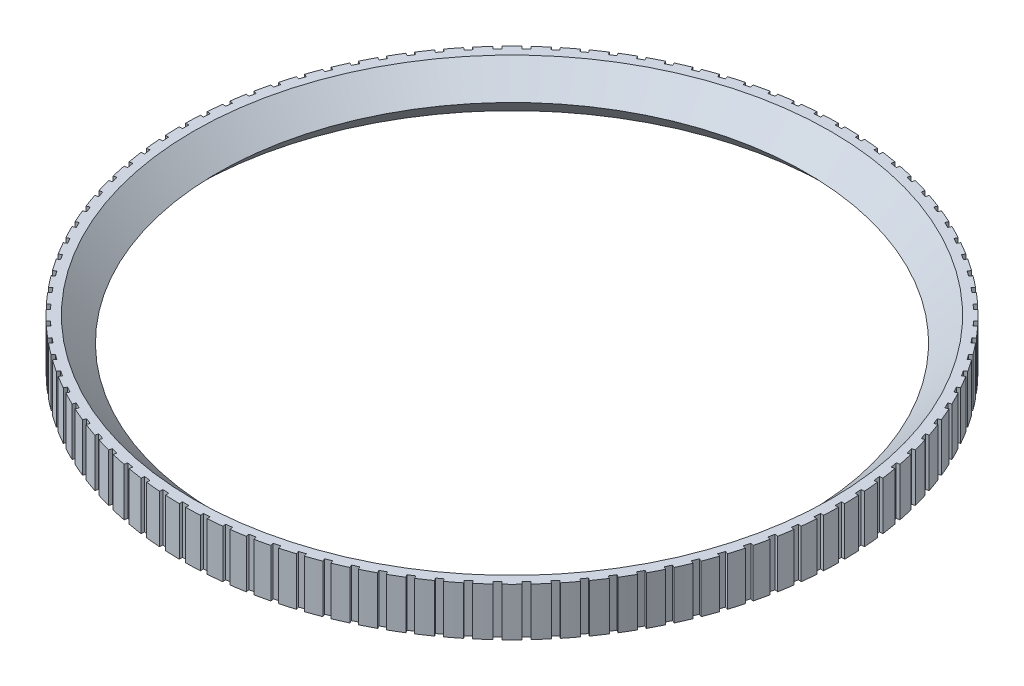
from build123d import *

# Parameters (mm, degrees)
SKETCH2_W          = 1
SKETCH2_H          = 1
CUT_EXTRUDE1_DEPTH = 74.972980202
CIRPATTERN1_COUNT  = 100


with BuildPart() as part:
    # Sketch1 → Revolve1 (revolve)
    with BuildSketch(Plane(origin=(0, 0, 0), x_dir=(0, 0, -1), z_dir=(1, 0, 0))):
        Polygon((-52.03, 3.8), (-52.03, -3.8), (-50.312842712, -3.8), (-46.512842712, 0), (-50.312842712, 3.8), align=None)
    revolve(axis=Axis((0, 0, 0), (0, -1, 0)))

    # Sketch2 → Cut-Extrude1 (cut, through all)
    with BuildSketch(Plane.XZ.offset(3.8)):
        with Locations((0, -52.03)):
            Rectangle(SKETCH2_W, SKETCH2_H)
    cut_extrude1 = extrude(amount=-CUT_EXTRUDE1_DEPTH, mode=Mode.SUBTRACT)

    # CirPattern1: Cut-Extrude1 ×100 about axis
    cirpattern1_axis = Axis((0, 0, 0), (0, 1, 0))
    for i in range(1, CIRPATTERN1_COUNT):
        add(cut_extrude1.rotate(cirpattern1_axis, i * 360 / CIRPATTERN1_COUNT), mode=Mode.SUBTRACT)


solid = part.part
